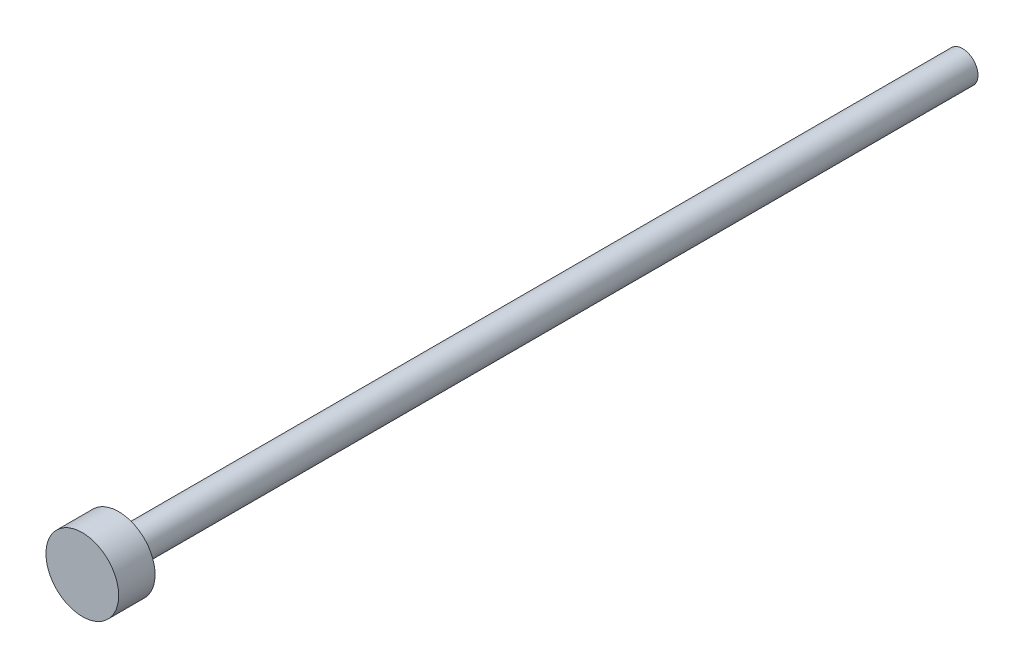
from build123d import *

# Parameters (mm, degrees)
EXTRUDE_1_DEPTH      = 1
EXTRUDE_1_DEPTH_BACK = 23.2
SKETCH_2_R           = 0.425
SKETCH_4_R           = 1
SKETCH_4_R_2         = 0.425
EXTRUDE_2_DEPTH      = 1


with BuildPart() as part:
    # 草图2 → 凸台-拉伸1 (new, two sides: drawn at the far end of the back side and taken through both)
    with BuildSketch(Plane.XY.offset(-EXTRUDE_1_DEPTH_BACK)):
        with Locations((3.25, -1.5)):
            Circle(SKETCH_2_R)
    extrude(amount=EXTRUDE_1_DEPTH + EXTRUDE_1_DEPTH_BACK)

    # 草图4 → 凸台-拉伸2 (add)
    # profile 1 of 2: a face of its own
    with BuildSketch(Plane.XY.offset(1)):
        with Locations((3.25, -1.5)):
            Circle(SKETCH_4_R)
        with Locations(Location((3.25, -1.5, 0), (0, 0, 270))):
            Circle(SKETCH_4_R_2, mode=Mode.SUBTRACT)
    # profile 2 of 2: a face of its own
    with BuildSketch(Plane.XY.offset(1)):
        with Locations(Location((3.25, -1.5, 0), (0, 0, 270))):
            Circle(SKETCH_4_R_2)
    extrude(amount=-EXTRUDE_2_DEPTH)


solid = part.part
